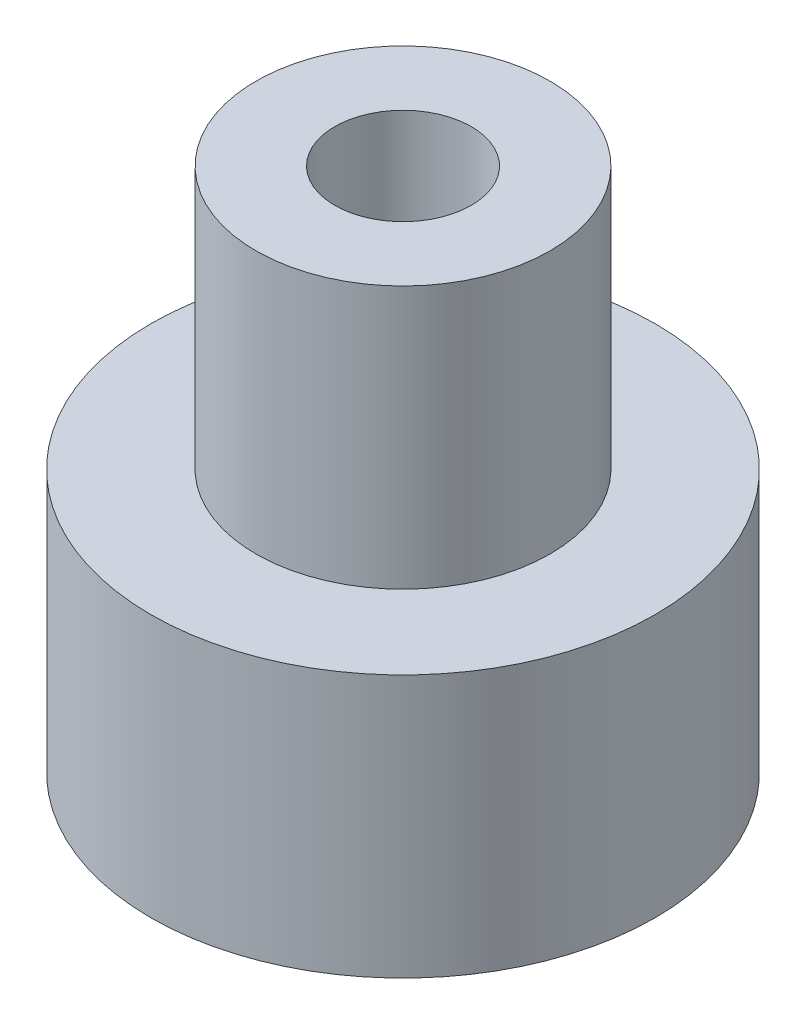
from build123d import *


with BuildPart() as part:
    # Sketch1 → Revolve1 (revolve)
    with BuildSketch(Plane.XY, mode=Mode.PRIVATE) as revolve1_sk:
        Polygon((-1.3, 5), (-2.8, 5), (-2.8, 0), (-4.8, 0), (-4.8, -5), (-1.3, -5), align=None)
    revolve(revolve1_sk.sketch.rotate(Axis((0, -1000, 0), (0, 1, 0)), 180), axis=Axis((0, -1000, 0), (0, 1, 0)))


solid = part.part
